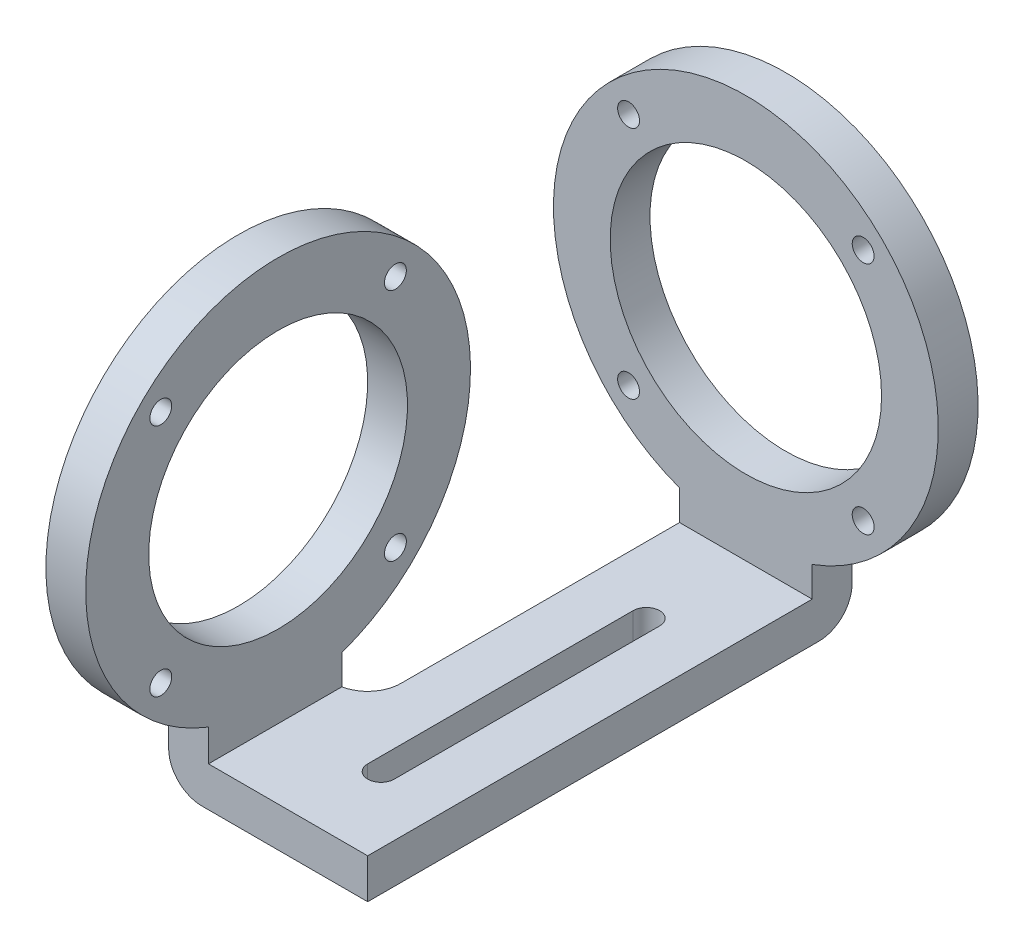
from build123d import *

# Parameters (mm, degrees)
SKETCH1_R           = 29
SKETCH1_R_2         = 20.45
SKETCH1_R_3         = 1.65
BOSS_EXTRUDE1_DEPTH = 6
BOSS_EXTRUDE3_DEPTH = 6
SKETCH4_W           = 20
SKETCH4_H           = 6
BOSS_EXTRUDE4_DEPTH = 67
SKETCH5_W           = 20
SKETCH5_H           = 6
BOSS_EXTRUDE5_DEPTH = 10
SKETCH7_R           = 29
SKETCH7_R_2         = 1.65
SKETCH7_R_3         = 19.5
BOSS_EXTRUDE6_DEPTH = 6
SKETCH8_W           = 6
SKETCH8_H           = 20
BOSS_EXTRUDE8_DEPTH = 6
CUT_EXTRUDE1_DEPTH  = 6
FILLET1_R           = 5
FILLET2_R           = 5


with BuildPart() as part:
    # Sketch1 → Boss-Extrude1 (new body)
    with BuildSketch(Plane.XY):
        Circle(SKETCH1_R)
        Circle(SKETCH1_R_2, mode=Mode.SUBTRACT)
        with Locations((17.68, -17.68)):
            Circle(SKETCH1_R_3, mode=Mode.SUBTRACT)
        with Locations((-17.68, -17.68)):
            Circle(SKETCH1_R_3, mode=Mode.SUBTRACT)
        with Locations((-17.68, 17.68)):
            Circle(SKETCH1_R_3, mode=Mode.SUBTRACT)
        with Locations((17.68, 17.68)):
            Circle(SKETCH1_R_3, mode=Mode.SUBTRACT)
    extrude(amount=BOSS_EXTRUDE1_DEPTH)

    # Sketch3 → Boss-Extrude3 (add)
    with BuildSketch(Plane.XY.offset(6)):
        Polygon((0, -25.748471389), (-10, -25.748471389), (-10, -37.748471389), (10, -37.748471389), (10, -25.748471389), align=None)
    extrude(amount=-BOSS_EXTRUDE3_DEPTH)

    # Sketch4 → Boss-Extrude4 (add)
    with BuildSketch(Plane.XY.offset(6)):
        with Locations((0, -34.748471389)):
            Rectangle(SKETCH4_W, SKETCH4_H)
    extrude(amount=BOSS_EXTRUDE4_DEPTH)

    # Sketch5 → Boss-Extrude5 (add)
    with BuildSketch(Plane.ZY.offset(10)):
        with Locations((63, -34.748471389)):
            Rectangle(SKETCH5_W, SKETCH5_H)
    extrude(amount=BOSS_EXTRUDE5_DEPTH)



with BuildPart() as body_2:
    # Sketch7 → Boss-Extrude6 (new body)
    with BuildSketch(Plane.ZY.offset(20)):
        with Locations(Location((62.50384549, 0.087350514, 0), (0, 0, 270))):
            Circle(SKETCH7_R)
        with Locations(Location((80.18384549, -17.592649486, 0), (0, 0, 270))):
            Circle(SKETCH7_R_2, mode=Mode.SUBTRACT)
        with Locations(Location((44.82384549, -17.592649486, 0), (0, 0, 270))):
            Circle(SKETCH7_R_2, mode=Mode.SUBTRACT)
        with Locations(Location((44.82384549, 17.767350514, 0), (0, 0, 270))):
            Circle(SKETCH7_R_2, mode=Mode.SUBTRACT)
        with Locations(Location((80.18384549, 17.767350514, 0), (0, 0, 270))):
            Circle(SKETCH7_R_2, mode=Mode.SUBTRACT)
        with Locations(Location((62.50384549, 0.087350514, 0), (0, 0, 270))):
            Circle(SKETCH7_R_3, mode=Mode.SUBTRACT)
    extrude(amount=-BOSS_EXTRUDE6_DEPTH)


with BuildPart() as part_1:
    add(part.part)

    add(body_2.part)  # Boss-Extrude8 merges body 2
    # Sketch8 → Boss-Extrude8 (add)
    with BuildSketch(Plane(origin=(0, -31.748471389, 0), x_dir=(1, 0, 0), z_dir=(0, 1, 0))):
        with Locations((-17, -63)):
            Rectangle(SKETCH8_W, SKETCH8_H)
    extrude(amount=BOSS_EXTRUDE8_DEPTH)

    # Sketch9 → Cut-Extrude1 (cut)
    with BuildSketch(Plane.XZ.offset(37.748471389)):
        with BuildLine():
            Line((2, 61), (2, 21))
            ThreePointArc((2, 21), (0, 19), (-2, 21))
            Line((-2, 21), (-2, 61))
            ThreePointArc((-2, 61), (0, 63), (2, 61))
        make_face()
    extrude(amount=-CUT_EXTRUDE1_DEPTH, mode=Mode.SUBTRACT)

    # Fillet1
    fillet1_edges = [part_1.edges().sort_by_distance(p)[0] for p in [
        (0, -37.748471389, 0),
        (-20, -37.748471389, 63),
    ]]
    fillet(fillet1_edges, radius=FILLET1_R)

    # Fillet2
    fillet2_edges = [part_1.edges().sort_by_distance(p)[0] for p in [
        (-10, -34.748471389, 53),
    ]]
    fillet(fillet2_edges, radius=FILLET2_R)


solid = part_1.part
